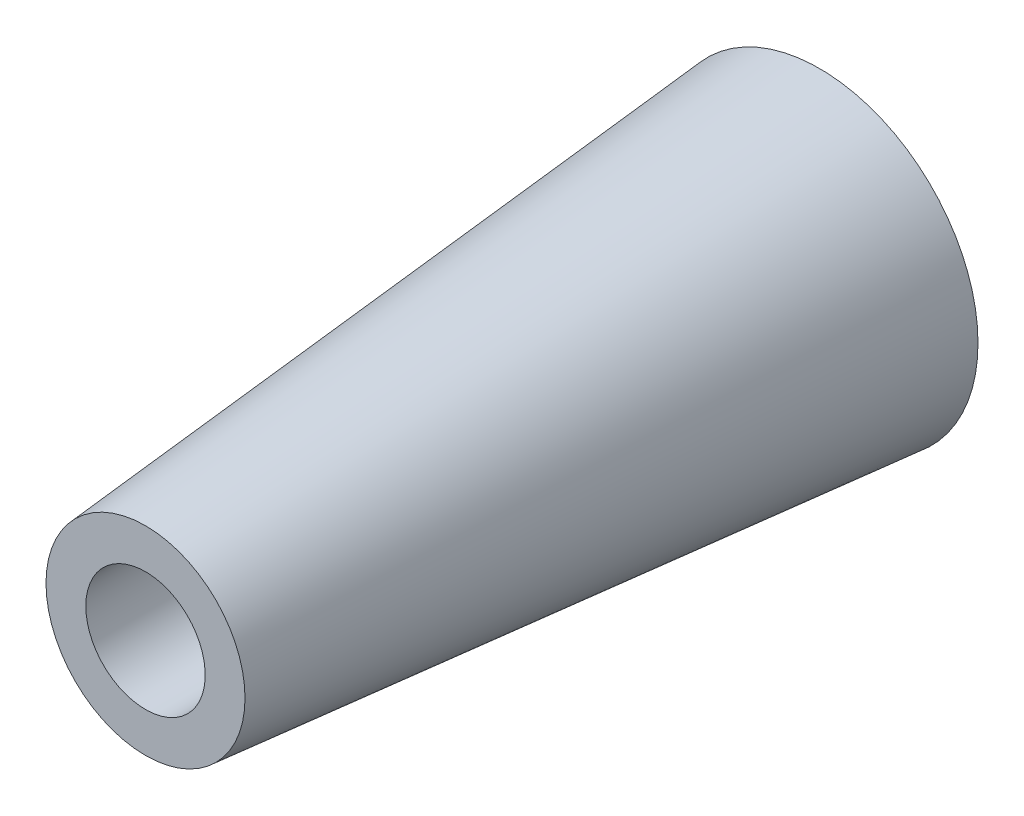
from build123d import *

# Parameters (mm, degrees)
SKETCH1_R          = 7.5
BOSS_EXTRUDE_DEPTH = 50.8
DRAFT3_ANGLE       = 5
SKETCH2_R          = 4.5
CUT_EXTRUDE1_DEPTH = 54.534834776


with BuildPart() as part:
    # Sketch1 → Boss-Extrude (new body)
    with BuildSketch(Plane.XY):
        Circle(SKETCH1_R)
    extrude(amount=BOSS_EXTRUDE_DEPTH)

    # Draft3
    draft3_faces = [part.faces().sort_by_distance(p)[0] for p in [
        (-7.5, 0, 25.4),
    ]]
    draft(draft3_faces, Plane.XY.offset(50.8), DRAFT3_ANGLE)

    # Sketch2 → Cut-Extrude1 (cut, through all)
    with BuildSketch(Plane(origin=(0, 0, 0), x_dir=(-1, 0, 0), z_dir=(0, 0, -1))):
        Circle(SKETCH2_R)
    extrude(amount=-CUT_EXTRUDE1_DEPTH, mode=Mode.SUBTRACT)


solid = part.part
